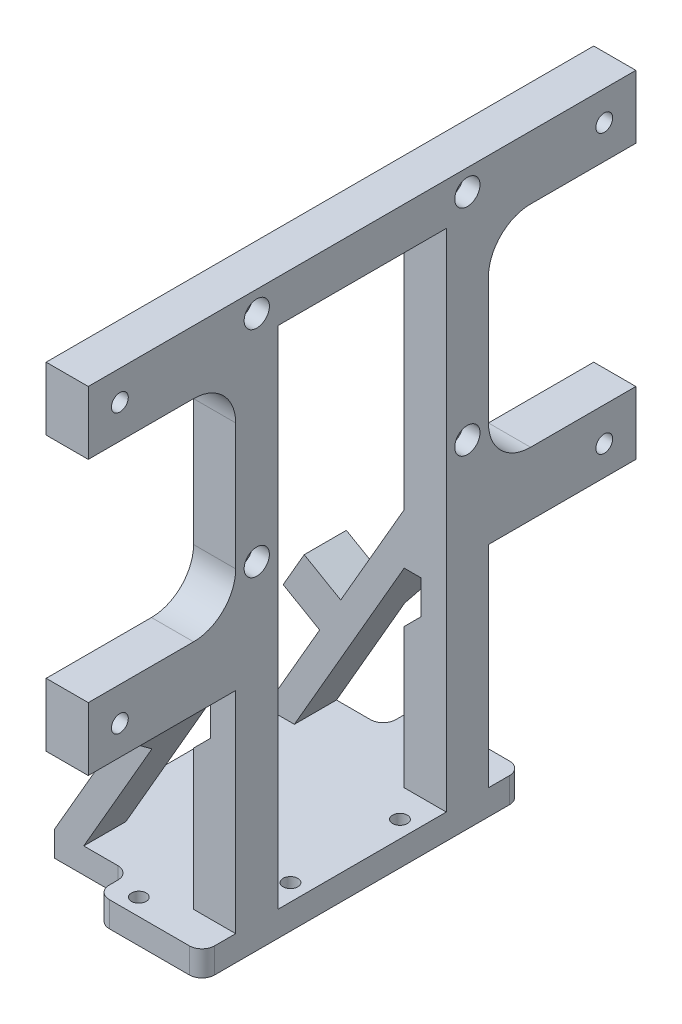
from build123d import *

# Parameters (mm, degrees)
SKETCH_1_W          = 35
SKETCH_1_H          = 60
SKETCH_1_W_2        = 8
EXTRUDE_1_DEPTH     = 6
HOLE_WIZARD_1_D     = 3.5
FILLET_1_R          = 3
SKETCH_5_W          = 10
SKETCH_5_H          = 10
EXTRUDE_2_DEPTH     = 120
SKETCH_10_W         = 10
SKETCH_10_H         = 60
EXTRUDE_5_DEPTH     = 10
HOLE_WIZARD_2_D     = 3.5
HOLE_WIZARD_3_D     = 6
HOLE_WIZARD_3_DEPTH = 4
EXTRUDE_6_DEPTH     = 10
SKETCH_18_W         = 35
SKETCH_18_H         = 15
EXTRUDE_7_DEPTH     = 10
HOLE_WIZARD_4_D     = 4
FILLET_2_R          = 10
FILLET_3_R          = 3
SKETCH_21_W         = 10
SKETCH_21_H         = 10
EXTRUDE_8_DEPTH     = 6
HOLE_WIZARD_5_D     = 4
SKETCH_25_W         = 10
SKETCH_25_H         = 10
EXTRUDE_9_DEPTH     = 10
SKETCH_28_W         = 4
SKETCH_28_H         = 8
CUT_EXTRUDE_1_DEPTH = 172.37677789
CUT_EXTRUDE_2_DEPTH = 172.37677789


with BuildPart() as part:
    # 草图1 → 凸台-拉伸1 (new body)
    with BuildSketch(Plane(origin=(0, 0, 0), x_dir=(1, 0, 0), z_dir=(0, 1, 0))):
        Polygon((18, 68), (18, 60), (35, 60), (43, 60), (43, 68), align=None)
        with Locations((17.5, 30)):
            Rectangle(SKETCH_1_W, SKETCH_1_H)
        with Locations((39, 30)):
            Rectangle(SKETCH_1_W_2, SKETCH_1_H)
        Polygon((35, 0), (18, 0), (18, -8), (43, -8), (43, 0), align=None)
    extrude(amount=EXTRUDE_1_DEPTH)

    # 孔1 (through all)
    with Locations(Plane(origin=(0, 6, 0), x_dir=(1, 0, 0), z_dir=(0, 1, 0))):
        with Locations((24, 64), (39, 43), (39, 17), (24, -4)):
            Hole(HOLE_WIZARD_1_D / 2)

    # 圆角1
    fillet_1_edges = [part.edges().sort_by_distance(p)[0] for p in [
        (18, 3, 8),
        (18, 3, 0),
        (18, 3, -68),
        (43, 3, -68),
        (43, 3, 8),
    ]]
    fillet(fillet_1_edges, radius=FILLET_1_R)

    # 草图5 → 凸台-拉伸2 (add)
    with BuildSketch(Plane(origin=(0, 6, 0), x_dir=(1, 0, 0), z_dir=(0, 1, 0))):
        with Locations((38, 55)):
            Rectangle(SKETCH_5_W, SKETCH_5_H)
        with Locations((38, 5)):
            Rectangle(SKETCH_5_W, SKETCH_5_H)
    extrude(amount=EXTRUDE_2_DEPTH)

    # 草图10 → 凸台-拉伸5 (add)
    with BuildSketch(Plane(origin=(0, 126, 0), x_dir=(1, 0, 0), z_dir=(0, 1, 0))):
        with Locations((38, 30)):
            Rectangle(SKETCH_10_W, SKETCH_10_H)
    extrude(amount=EXTRUDE_5_DEPTH)

    # 孔2 (through all)
    with Locations(Plane(origin=(43, 0, 0), x_dir=(0, 0, -1), z_dir=(1, 0, 0))):
        with Locations((5, 131), (55, 131), (55, 80), (5, 80)):
            Hole(HOLE_WIZARD_2_D / 2)

    # 孔3
    with Locations(Plane(origin=(43, 0, 0), x_dir=(0, 0, -1), z_dir=(1, 0, 0))):
        with Locations((5, 131), (5, 80), (55, 80), (55, 131)):
            Hole(HOLE_WIZARD_3_D / 2, depth=HOLE_WIZARD_3_DEPTH)

    # 草图16 → 凸台-拉伸6 (add)
    with BuildSketch(Plane(origin=(0, 0, -60), x_dir=(-1, 0, 0), z_dir=(0, 0, -1))):
        Polygon((-33, 51.15767665), (-6.92820323, 6), (0, 6), (-33, 63.15767665), align=None)
    extrude_6 = extrude(amount=-EXTRUDE_6_DEPTH)

    # 镜向1: 凸台-拉伸6 across plane
    add(extrude_6.mirror(Plane.XY.offset(-30)))

    # 草图18 → 凸台-拉伸7 (add)
    with BuildSketch(Plane.ZY.offset(-33)):
        with Locations((-77.5, 128.5)):
            Rectangle(SKETCH_18_W, SKETCH_18_H)
        with Locations((17.5, 128.5)):
            Rectangle(SKETCH_18_W, SKETCH_18_H)
        with Locations((-77.5, 63.5)):
            Rectangle(SKETCH_18_W, SKETCH_18_H)
        with Locations((17.5, 63.5)):
            Rectangle(SKETCH_18_W, SKETCH_18_H)
    extrude(amount=-EXTRUDE_7_DEPTH)

    # 孔4 (through all)
    with Locations(Plane.ZY.offset(-33)):
        with Locations((-87.5, 129), (27.5, 129), (27.5, 63), (-87.5, 63)):
            Hole(HOLE_WIZARD_4_D / 2)

    # 圆角2
    fillet_2_edges = [part.edges().sort_by_distance(p)[0] for p in [
        (38, 121, -60),
        (38, 121, 0),
        (38, 71, -60),
        (38, 71, 0),
    ]]
    fillet(fillet_2_edges, radius=FILLET_2_R)

    # 圆角3
    fillet_3_edges = [part.edges().sort_by_distance(p)[0] for p in [
        (18, 3, -60),
    ]]
    fillet(fillet_3_edges, radius=FILLET_3_R)

    # 草图21 → 凸台-拉伸8 (add)
    with BuildSketch(Plane(origin=(-2.598076211, 1.5, 0), x_dir=(0, 0, 1), z_dir=(-0.8660254037844363, 0.5000000000000042, 0))):
        Polygon((-60, 51.059600438), (-70, 51.059600438), (-60, 41.059600438), align=None)
        with Locations((-65, 56.059600438)):
            Rectangle(SKETCH_21_W, SKETCH_21_H)
        with Locations((5, 56.059600438)):
            Rectangle(SKETCH_21_W, SKETCH_21_H)
        Polygon((0, 51.059600438), (10, 51.059600438), (0, 41.059600438), align=None)
    extrude(amount=-EXTRUDE_8_DEPTH)

    # 孔5 (through all)
    with Locations(Plane(origin=(-2.598076211, 1.5, 0), x_dir=(0, 0, 1), z_dir=(-0.8660254037844363, 0.5000000000000042, 0))):
        with Locations((-62, 56.059600438), (2, 56.059600438)):
            Hole(HOLE_WIZARD_5_D / 2)

    # 草图25 → 凸台-拉伸9 (add)
    with BuildSketch(Plane(origin=(-2.598076211, 1.5, 0), x_dir=(0, 0, 1), z_dir=(-0.8660254037844363, 0.5000000000000042, 0))):
        with Locations((-55, 36.059600438)):
            Rectangle(SKETCH_25_W, SKETCH_25_H)
        with Locations((-5, 36.059600438)):
            Rectangle(SKETCH_25_W, SKETCH_25_H)
    extrude(amount=EXTRUDE_9_DEPTH)

    # 草图28 → 切除-拉伸1 (cut, through all)
    with BuildSketch(Plane(origin=(0, 0, -60), x_dir=(-1, 0, 0), z_dir=(0, 0, -1))):
        with Locations((-35, 47.15767665)):
            Rectangle(SKETCH_28_W, SKETCH_28_H)
    extrude(amount=-CUT_EXTRUDE_1_DEPTH, mode=Mode.SUBTRACT)

    # 草图29 → 切除-拉伸2 (cut, through all)
    with BuildSketch(Plane(origin=(0, 0, -60), x_dir=(-1, 0, 0), z_dir=(0, 0, -1))):
        Polygon((-37, 43.15767665), (-33, 43.15767665), (-33, 39.15767665), align=None)
    extrude(amount=-CUT_EXTRUDE_2_DEPTH, mode=Mode.SUBTRACT)


solid = part.part
